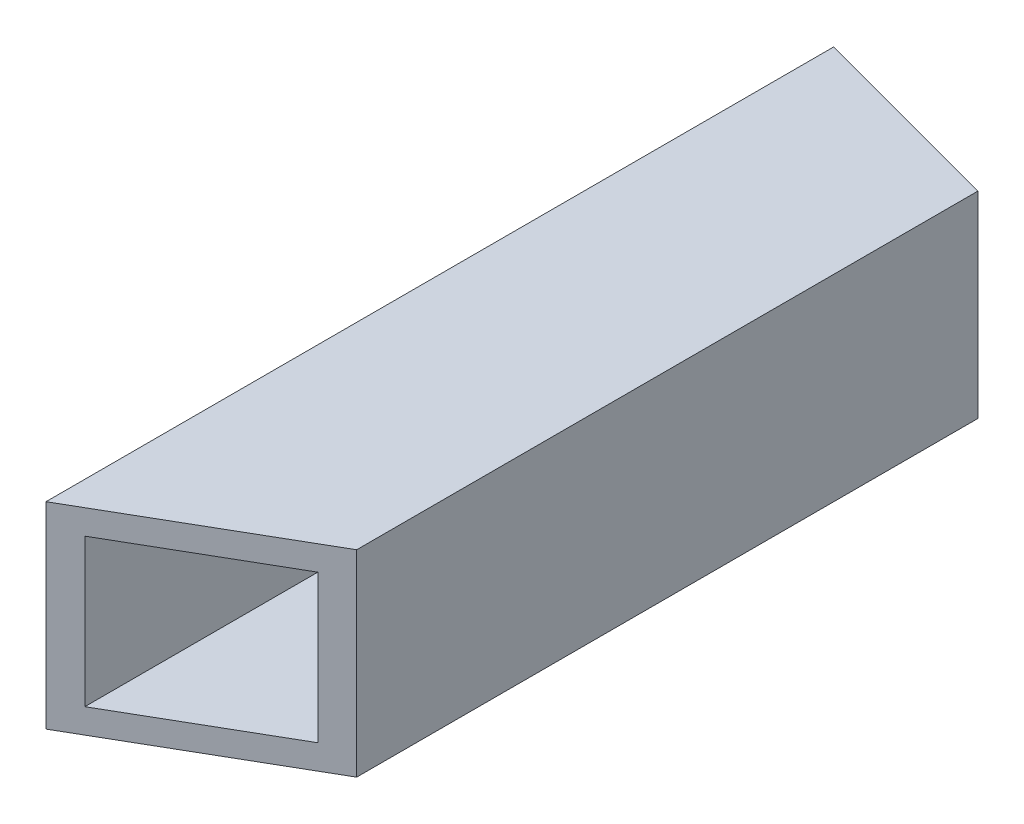
from build123d import *

# Parameters (mm, degrees)
SKETCH1_W           = 25.4
SKETCH1_H           = 25.4
SKETCH1_W_2         = 19.05
SKETCH1_H_2         = 19.05
BOSS_EXTRUDE1_DEPTH = 101.6
SKETCH2_W           = 25.4
SKETCH2_H           = 26.296014983
CUT_EXTRUDE1_DEPTH  = 101.161834767
SKETCH5_W           = 25.4
SKETCH5_H           = 29.329393675
CUT_EXTRUDE2_DEPTH  = 90.577773471


with BuildPart() as part:
    # Sketch1 → Boss-Extrude1 (new body)
    with BuildSketch(Plane.XY):
        Rectangle(SKETCH1_W, SKETCH1_H)
        Rectangle(SKETCH1_W_2, SKETCH1_H_2, mode=Mode.SUBTRACT)
    extrude(amount=BOSS_EXTRUDE1_DEPTH)

    # Sketch2 → Cut-Extrude1 (cut, through all)
    with BuildSketch(Plane(origin=(-0.850738686, 0, 3.175), x_dir=(0, -1, 0), z_dir=(0.25881904510252135, 0, -0.9659258262890681))):
        with Locations((0, -0.880749498)):
            Rectangle(SKETCH2_W, SKETCH2_H)
    extrude(amount=CUT_EXTRUDE1_DEPTH, mode=Mode.SUBTRACT)

    # Sketch5 → Cut-Extrude2 (cut, through all)
    with BuildSketch(Plane(origin=(40.819090512, 0, 70.700738686), x_dir=(0, -1, 0), z_dir=(0.4999999999999889, 0, 0.866025403784445))):
        with Locations((0, -47.13382579)):
            Rectangle(SKETCH5_W, SKETCH5_H)
    extrude(amount=CUT_EXTRUDE2_DEPTH, mode=Mode.SUBTRACT)


solid = part.part
